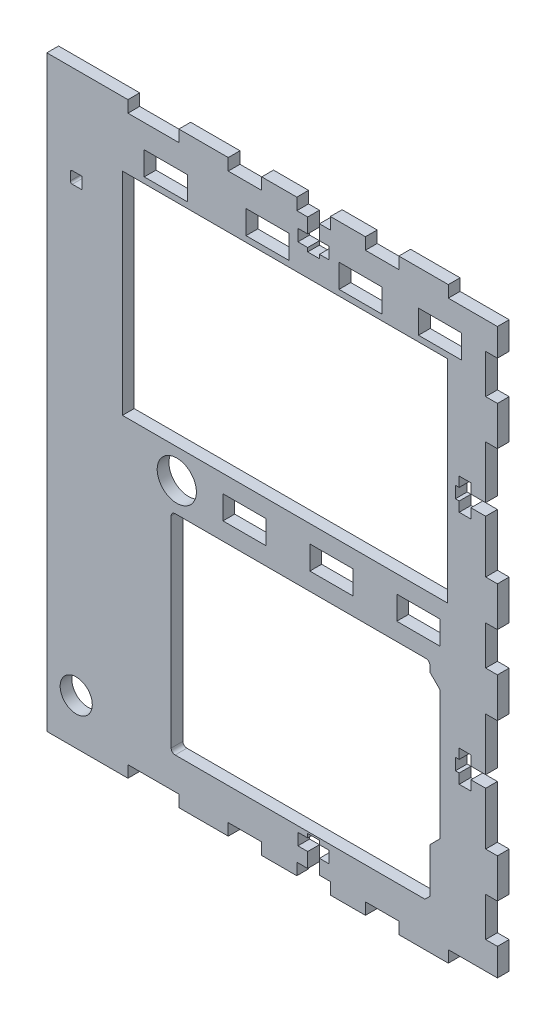
from build123d import *

# Parameters (mm, degrees)
CROQUIS1_R              = 5.000000001
CROQUIS1_W              = 11.000000002
CROQUIS1_H              = 6.000000001
CROQUIS1_W_2            = 11.000000001
CROQUIS1_W_3            = 83.00000001
CROQUIS1_H_2            = 54.000000007
SALIENTE_EXTRUIR1_DEPTH = 1.5
CROQUIS3_W              = 3
CROQUIS3_H              = 143.999988457
SALIENTE_EXTRUIR2_DEPTH = 15
CROQUIS4_R              = 4.1
CORTAR_EXTRUIR1_DEPTH   = 23
CROQUIS8_W              = 20.699997559
CROQUIS8_H              = 3
SALIENTE_EXTRUIR4_DEPTH = 3
CROQUIS9_W              = 20.699997559
CROQUIS9_H              = 3
SALIENTE_EXTRUIR5_DEPTH = 3


with BuildPart() as part:
    # Croquis1 → Saliente-Extruir1 (new, symmetric)
    with BuildSketch(Plane.XY):
        Polygon((18.699888738, 146.999988499), (-0.000108821, 146.999988499), (-0.000108821, 3.000000042), (18.699888738, 3.000000042), (18.699888738, -1.1561e-05), (31.299897882, -1.1561e-05), (31.299897882, 2.999988439), (39.849897883, 2.999988439), (39.849897883, 6.5452e-05), (48.799897884, 6.5452e-05), (48.799897884, 3.000065452), (51.579549154, 3.000065452), (51.579549154, 6.749716476), (49.079130382, 6.749716476), (49.079130382, 9.750065453), (51.579549154, 9.750065453), (51.579549154, 10.725065453), (54.579549155, 10.725065453), (54.579549155, 9.750065453), (57.079549155, 9.750065453), (57.079549155, 6.749716476), (54.579549155, 6.749716476), (54.579549155, 3.000065452), (57.359200426, 3.000065452), (57.359200426, 9.8389e-05), (66.309200426, 9.8389e-05), (66.309200426, 3.00009839), (74.840541181, 3.00009839), (74.840541181, 9.8305e-05), (87.461202556, 0.000103657), (87.461202556, 3.000103699), (99.999885723, 3.000103699), (99.999885723, 9.999884868), (96.999885722, 9.999884868), (96.999885722, 19.999884869), (99.999885723, 19.999884869), (99.999885723, 29.99988487), (96.999885722, 29.99988487), (96.999885722, 43.437175485), (93.250234699, 43.437175485), (93.250234699, 40.937175485), (90.249885721, 40.937175485), (90.249885721, 43.437175485), (89.274885721, 43.437175485), (89.274885721, 46.437175486), (90.249885721, 46.437175486), (90.249885721, 48.937594258), (93.250234699, 48.937594258), (93.250234699, 46.437175486), (96.999885722, 46.437175486), (96.999885722, 59.874884873), (99.999885723, 59.874884873), (99.999885723, 69.999884875), (96.999885722, 69.999884875), (96.999885722, 79.999884876), (99.999885723, 79.999884876), (99.999885723, 90.124884877), (96.999885722, 90.124884877), (96.999885722, 103.562175492), (93.250234699, 103.562175492), (93.250234699, 101.062175492), (90.249885721, 101.062175492), (90.249885721, 103.562175492), (89.274885721, 103.562175492), (89.274885721, 106.562175493), (90.249885721, 106.562175493), (90.249885721, 109.062594265), (93.250234699, 109.062594265), (93.250234699, 106.562175493), (96.999885722, 106.562175493), (96.999885722, 119.99988488), (99.999885723, 119.99988488), (99.999885723, 129.999884881), (96.999885722, 129.999884881), (96.999885722, 139.999884883), (99.999885723, 139.999884883), (99.999885723, 146.999884842), (87.461202556, 146.999884842), (87.461202556, 149.999884884), (74.840541181, 149.999890236), (74.840541181, 146.999890151), (66.309200426, 146.999890151), (66.309200426, 149.999890151), (57.359200426, 149.999890151), (57.359200426, 146.999923088), (54.579549155, 146.999923088), (54.579549155, 143.250272065), (57.079549155, 143.250272065), (57.079549155, 140.249923087), (54.579549155, 140.249923087), (54.579549155, 139.274923087), (51.579549154, 139.274923087), (51.579549154, 140.249923087), (49.079130382, 140.249923087), (49.079130382, 143.250272065), (51.579549154, 143.250272065), (51.579549154, 146.999923088), (48.799897884, 146.999923088), (48.799897884, 149.999923089), (39.849897883, 149.999923089), (39.849897883, 147.000000101), (31.299897882, 147.000000101), (31.299897882, 150.000000101), (18.699888738, 150.000000101), align=None)
        with Locations((18.167765659, 72.011021453)):
            Circle(CROQUIS1_R, mode=Mode.SUBTRACT)
        with Locations((35.451849713, 72.011021453)):
            Rectangle(CROQUIS1_W, CROQUIS1_H, mode=Mode.SUBTRACT)
        with BuildLine():
            Line((82.774554778, 63.495021452), (82.774554778, 61.971021451))
            Line((82.774554778, 61.971021451), (85.314554779, 59.431021451))
            Line((85.314554779, 59.431021451), (85.314554779, 26.411021447))
            Line((85.314554779, 26.411021447), (82.774554778, 23.871021447))
            Line((82.774554778, 23.871021447), (82.774554778, 12.441021446))
            Line((82.774554778, 12.441021446), (81.504554778, 11.171021446))
            Line((81.504554778, 11.171021446), (17.750554771, 11.171021446))
            ThreePointArc((17.750554771, 11.171021446), (17.032134281, 11.468600956), (16.734554771, 12.187021446))
            Line((16.734554771, 12.187021446), (16.734554771, 63.495021452))
            ThreePointArc((16.734554771, 63.495021452), (17.032134281, 64.213441941), (17.750554771, 64.511021452))
            Line((17.750554771, 64.511021452), (81.758554778, 64.511021452))
            ThreePointArc((81.758554778, 64.511021452), (82.476975268, 64.213441941), (82.774554778, 63.495021452))
        make_face(mode=Mode.SUBTRACT)
        with Locations((57.631849716, 72.011021453)):
            Rectangle(CROQUIS1_W_2, CROQUIS1_H, mode=Mode.SUBTRACT)
        with Locations((79.814554778, 72.011021453)):
            Rectangle(CROQUIS1_W, CROQUIS1_H, mode=Mode.SUBTRACT)
        with Locations((45.799885716, 106.511021457)):
            Rectangle(CROQUIS1_W_3, CROQUIS1_H_2, mode=Mode.SUBTRACT)
        with Locations((15.358852485, 137.999884882)):
            Rectangle(CROQUIS1_W_2, CROQUIS1_H, mode=Mode.SUBTRACT)
        with Locations((41.342185821, 137.999884882)):
            Rectangle(CROQUIS1_W_2, CROQUIS1_H, mode=Mode.SUBTRACT)
        with Locations((65.074870839, 137.999884882)):
            Rectangle(CROQUIS1_W_2, CROQUIS1_H, mode=Mode.SUBTRACT)
        with Locations((85.358852493, 137.999884882)):
            Rectangle(CROQUIS1_W_2, CROQUIS1_H, mode=Mode.SUBTRACT)
    extrude(amount=SALIENTE_EXTRUIR1_DEPTH, both=True)

    # Croquis3 → Saliente-Extruir2 (add)
    with BuildSketch(Plane.ZY.offset(0.000108821)):
        with Locations((0, 74.999994271)):
            Rectangle(CROQUIS3_W, CROQUIS3_H)
    extrude(amount=SALIENTE_EXTRUIR2_DEPTH)

    # Croquis4 → Cortar-Extruir1 (cut)
    with BuildSketch(Plane.XY.offset(1.5)):
        with Locations((-7.499965561, 11.700000042)):
            Circle(CROQUIS4_R)
        with BuildLine():
            Line((-5.999990973, 127.200018373), (-8.499990973, 127.200018373))
            ThreePointArc((-8.499990973, 127.200018373), (-8.853544364, 127.053571764), (-8.999990973, 126.700018373))
            Line((-8.999990973, 126.700018373), (-8.999990973, 124.700000042))
            ThreePointArc((-8.999990973, 124.700000042), (-8.853544364, 124.346446651), (-8.499990973, 124.200000042))
            Line((-8.499990973, 124.200000042), (-5.999990973, 124.200000042))
            Line((-5.999990973, 124.200000042), (-5.999990973, 127.200018373))
        make_face()
    extrude(amount=-CORTAR_EXTRUIR1_DEPTH, mode=Mode.SUBTRACT)

    # Croquis8 → Saliente-Extruir4 (add)
    with BuildSketch(Plane.XZ.offset(-3.000000042)):
        with Locations((-4.650110042, 0)):
            Rectangle(CROQUIS8_W, CROQUIS8_H)
    extrude(amount=SALIENTE_EXTRUIR4_DEPTH)

    # Croquis9 → Saliente-Extruir5 (add)
    with BuildSketch(Plane(origin=(0, 146.999988499, 0), x_dir=(1, 0, 0), z_dir=(0, 1, 0))):
        with Locations((-4.650110042, 0)):
            Rectangle(CROQUIS9_W, CROQUIS9_H)
    extrude(amount=SALIENTE_EXTRUIR5_DEPTH)


solid = part.part
